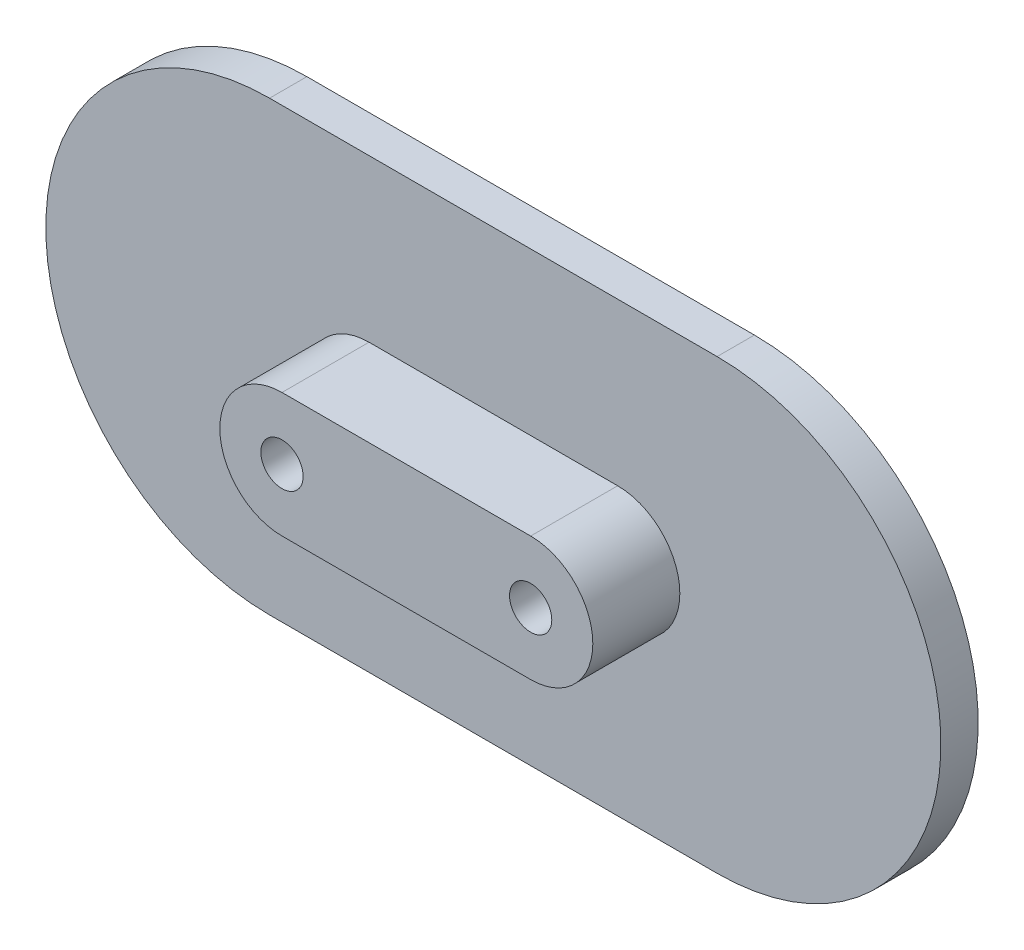
from build123d import *

# Parameters (mm, degrees)
EXTRUDE_1_DEPTH = 3
SKETCH_1_3_R    = 1.7
EXTRUDE_2_DEPTH = 10
CHAMFER_1_SIZE  = 1.4


with BuildPart() as part:
    # 草图1 → 凸台-拉伸1 (new body)
    with BuildSketch(Plane.XY):
        with BuildLine():
            Line((18, 18), (-18, 18))
            ThreePointArc((-18, 18), (-36, 0), (-18, -18))
            Line((-18, -18), (18, -18))
            ThreePointArc((18, -18), (36, 0), (18, 18))
        make_face()
        with BuildLine():
            ThreePointArc((-10, -5), (-15, 0), (-10, 5))
            Line((-10, 5), (10, 5))
            ThreePointArc((10, 5), (15, 0), (10, -5))
            Line((10, -5), (-10, -5))
        make_face(mode=Mode.SUBTRACT)
    extrude(amount=EXTRUDE_1_DEPTH)

    # 草图1<3> → 凸台-拉伸2 (add)
    with BuildSketch(Plane.XY):
        with BuildLine():
            Line((10, 5), (-10, 5))
            ThreePointArc((-10, 5), (-15, 0), (-10, -5))
            Line((-10, -5), (10, -5))
            ThreePointArc((10, -5), (15, 0), (10, 5))
        make_face()
        with Locations((-10, 0)):
            Circle(SKETCH_1_3_R, mode=Mode.SUBTRACT)
        with Locations((10, 0)):
            Circle(SKETCH_1_3_R, mode=Mode.SUBTRACT)
    extrude(amount=EXTRUDE_2_DEPTH)

    # 倒角1
    chamfer_1_edges = [part.edges().sort_by_distance(p)[0] for p in [
        (8.3, 0, 0),
        (-11.7, 0, 0),
    ]]
    chamfer(chamfer_1_edges, length=CHAMFER_1_SIZE)


solid = part.part
